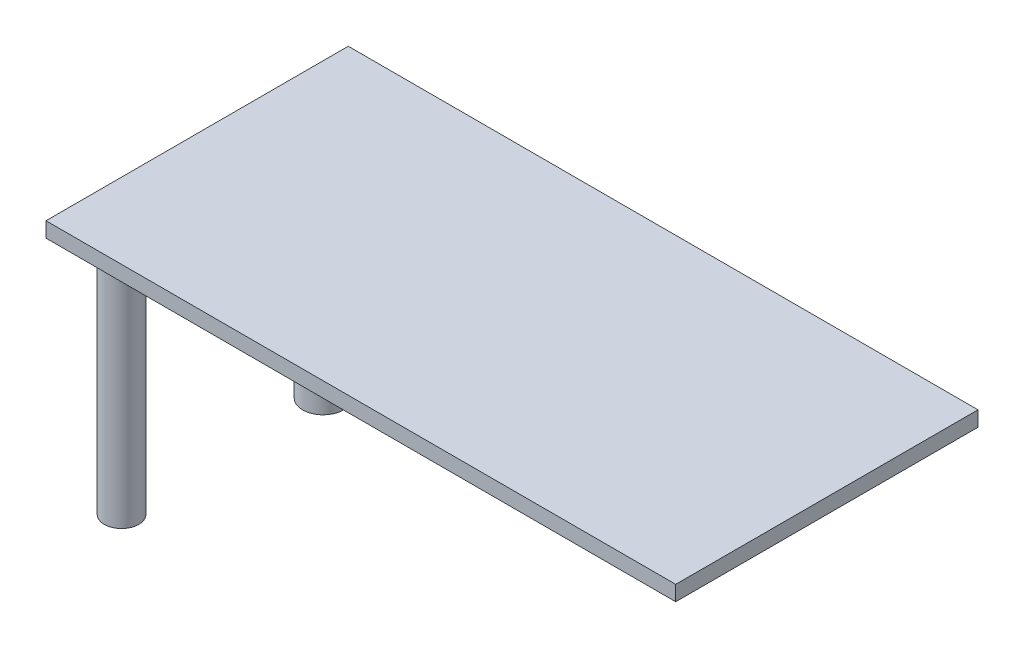
from build123d import *

# Parameters (mm, degrees)
SKETCH1_W           = 125
SKETCH1_H           = 60
BOSS_EXTRUDE1_DEPTH = 3
SKETCH2_R           = 3.419966531
SKETCH2_R_2         = 4.054363334
BOSS_EXTRUDE2_DEPTH = 50


with BuildPart() as part:
    # Sketch1 → Boss-Extrude1 (new body)
    with BuildSketch(Plane(origin=(0, 0, 0), x_dir=(1, 0, 0), z_dir=(0, 1, 0))):
        with Locations((62.5, 30)):
            Rectangle(SKETCH1_W, SKETCH1_H)
    extrude(amount=BOSS_EXTRUDE1_DEPTH)

    # Sketch2 → Boss-Extrude2 (add)
    with BuildSketch(Plane(origin=(0, 0, 0), x_dir=(-1, 0, 0), z_dir=(0, -1, 0))):
        with Locations(Location((-5, 10, 0), (0, 0, 90))):
            Circle(SKETCH2_R)
        with Locations(Location((-5, 50, 0), (0, 0, 90))):
            Circle(SKETCH2_R_2)
    extrude(amount=BOSS_EXTRUDE2_DEPTH)


solid = part.part
